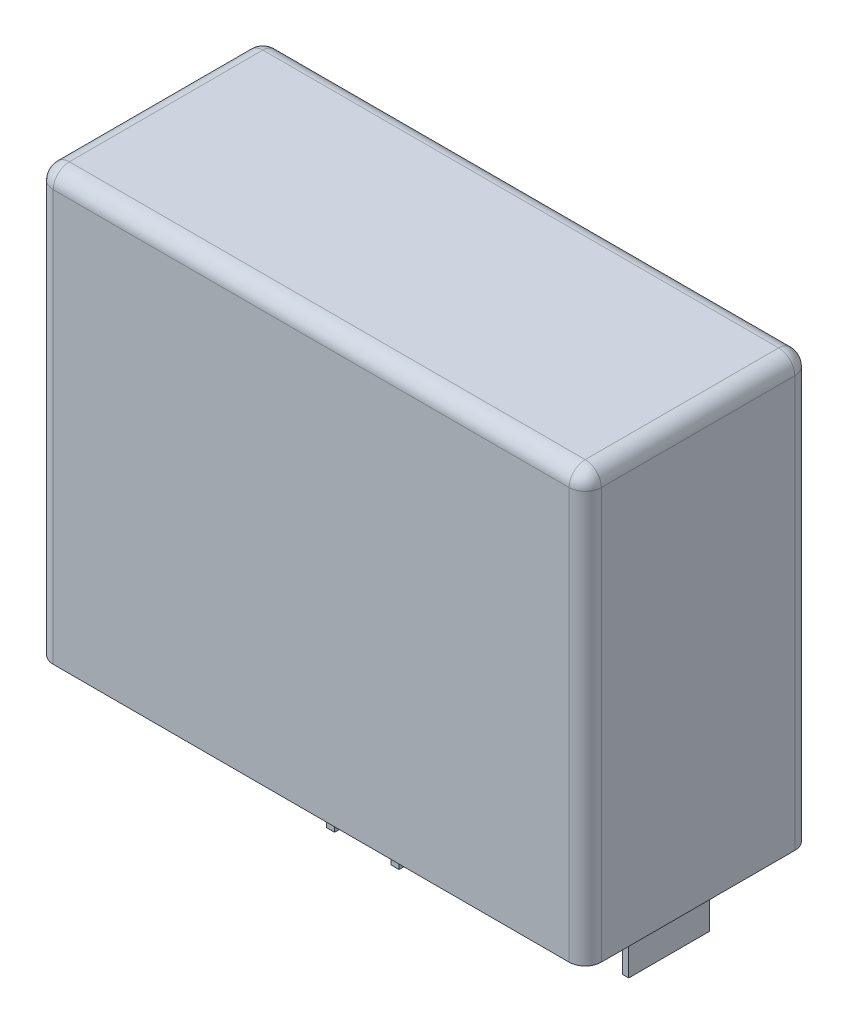
from build123d import *

# Parameters (mm, degrees)
BOSS_EXTRUDE1_DEPTH = 26.5
SKETCH2_W           = 0.4
SKETCH2_H           = 5
SKETCH2_W_2         = 0.5
SKETCH2_H_2         = 1
BOSS_EXTRUDE2_DEPTH = 3.5
FILLET1_R           = 1


with BuildPart() as part:
    # Sketch1 → Boss-Extrude1 (new body)
    with BuildSketch(Plane(origin=(0, 0, 0), x_dir=(1, 0, 0), z_dir=(0, 1, 0))):
        with BuildLine():
            Line((-16, -7), (16, -7))
            ThreePointArc((16, -7), (16.707106781, -6.707106781), (17, -6))
            Line((17, -6), (17, 6))
            ThreePointArc((17, 6), (16.707106781, 6.707106781), (16, 7))
            Line((16, 7), (-16, 7))
            ThreePointArc((-16, 7), (-16.707106781, 6.707106781), (-17, 6))
            Line((-17, 6), (-17, -6))
            ThreePointArc((-17, -6), (-16.707106781, -6.707106781), (-16, -7))
        make_face()
    extrude(amount=BOSS_EXTRUDE1_DEPTH)

    # Sketch2 → Boss-Extrude2 (add)
    with BuildSketch(Plane.XZ):
        with Locations((-15, 0)):
            Rectangle(SKETCH2_W, SKETCH2_H)
        with Locations((15, 0)):
            Rectangle(SKETCH2_W, SKETCH2_H)
        with Locations((-2, 3.3)):
            Rectangle(SKETCH2_W_2, SKETCH2_H_2)
        with Locations((2, 3.3)):
            Rectangle(SKETCH2_W_2, SKETCH2_H_2)
    extrude(amount=BOSS_EXTRUDE2_DEPTH)

    # Fillet1
    fillet1_edges = [part.edges().sort_by_distance(p)[0] for p in [
        (-16.707106781, 26.5, -6.707106781),
        (-17, 26.5, 0),
        (-16.707106781, 26.5, 6.707106781),
        (0, 26.5, 7),
        (16.707106781, 26.5, 6.707106781),
        (17, 26.5, 0),
        (16.707106781, 26.5, -6.707106781),
        (0, 26.5, -7),
    ]]
    fillet(fillet1_edges, radius=FILLET1_R)


solid = part.part
